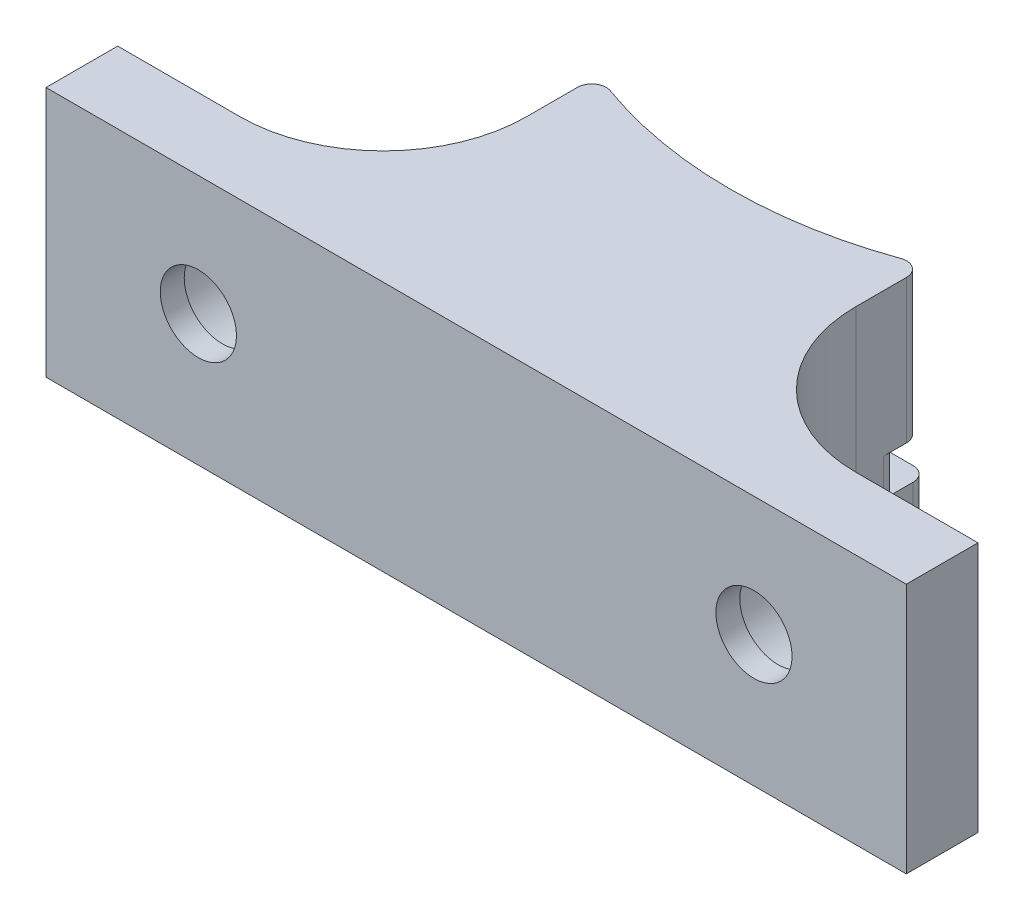
from build123d import *

# Parameters (mm, degrees)
BOSS_EXTRUDE1_DEPTH     = 25.4
BOSS_EXTRUDE2_DEPTH     = 6.604
SKETCH3_W               = 152.4
SKETCH3_H               = 50.8
BOSS_EXTRUDE3_DEPTH     = 12.446
SKETCH5_W               = 47.049242613
SKETCH5_H               = 38.1
CUT_EXTRUDE1_DEPTH      = 92.800885072
FILLET1_R               = 2.54
FILLET2_R               = 25.4
CUT_EXTRUDE2_DEPTH      = 8.4582
CUT_EXTRUDE2_DEPTH_BACK = 85.242269675
CUT_EXTRUDE2_START      = 12.7
SKETCH6_R               = 9.9187
SKETCH7_R               = 6.7437
CUT_EXTRUDE3_DEPTH      = 93.840002113


with BuildPart() as part:
    # Sketch1 → Boss-Extrude1 (new body)
    with BuildSketch(Plane(origin=(0, 0, 0), x_dir=(1, 0, 0), z_dir=(0, 1, 0))):
        with BuildLine():
            Line((76.2, -25.4), (76.2, 25.4))
            Line((76.2, 25.4), (29.150757387, 25.4))
            ThreePointArc((29.150757387, 25.4), (0, 19.601553837), (-29.150757387, 25.4))
            Line((-29.150757387, 25.4), (-76.2, 25.4))
            Line((-76.2, 25.4), (-76.2, -25.4))
            Line((-76.2, -25.4), (76.2, -25.4))
        make_face()
    extrude(amount=BOSS_EXTRUDE1_DEPTH)

    # Sketch2 → Boss-Extrude2 (add)
    with BuildSketch(Plane.XZ):
        with BuildLine():
            Line((-76.2, 25.4), (76.2, 25.4))
            Line((76.2, 25.4), (76.2, -21.59))
            Line((76.2, -21.59), (29.966893046, -21.59))
            ThreePointArc((29.966893046, -21.59), (0, -15.766153837), (-29.966893046, -21.59))
            Line((-29.966893046, -21.59), (-76.2, -21.59))
            Line((-76.2, -21.59), (-76.2, 25.4))
        make_face()
    extrude(amount=BOSS_EXTRUDE2_DEPTH)

    # Sketch3 → Boss-Extrude3 (add)
    with BuildSketch(Plane.XZ.offset(6.604)):
        Rectangle(SKETCH3_W, SKETCH3_H)
    extrude(amount=BOSS_EXTRUDE3_DEPTH)

    # Sketch5 → Cut-Extrude1 (cut, through all)
    with BuildSketch(Plane(origin=(0, 25.4, 0), x_dir=(1, 0, 0), z_dir=(0, 1, 0))):
        with Locations((-52.675378694, 6.35)):
            Rectangle(SKETCH5_W, SKETCH5_H)
        with Locations((52.675378694, 6.35)):
            Rectangle(SKETCH5_W, SKETCH5_H)
    extrude(amount=-CUT_EXTRUDE1_DEPTH, mode=Mode.SUBTRACT)

    # Fillet1
    fillet1_edges = [part.edges().sort_by_distance(p)[0] for p in [
        (29.150757387, 12.7, -25.4),
        (-29.150757387, 12.7, -25.4),
        (-29.150757387, -12.827, -25.4),
        (-29.150757387, -3.302, -21.265527456),
        (29.150757387, -12.827, -25.4),
        (29.150757387, -3.302, -21.265527456),
    ]]
    fillet(fillet1_edges, radius=FILLET1_R)

    # Fillet2
    fillet2_edges = [part.edges().sort_by_distance(p)[0] for p in [
        (-29.150757387, 3.175, 12.7),
        (29.150757387, 3.175, 12.7),
    ]]
    fillet(fillet2_edges, radius=FILLET2_R)

    # Sketch6 → Cut-Extrude2 (cut, two sides: drawn at the far end of the back side and taken through both)
    with BuildSketch(Plane.XY.offset(CUT_EXTRUDE2_START - CUT_EXTRUDE2_DEPTH_BACK)):
        with Locations(Location((49.2125, 4.191, 0), (0, 0, 302.561278337))):
            Circle(SKETCH6_R)
        with Locations(Location((-49.2125, 4.191, 0), (0, 0, 237.438721663))):
            Circle(SKETCH6_R)
    extrude(amount=CUT_EXTRUDE2_DEPTH + CUT_EXTRUDE2_DEPTH_BACK, mode=Mode.SUBTRACT)

    # Sketch7 → Cut-Extrude3 (cut, through all)
    with BuildSketch(Plane(origin=(0, 0, 21.1582), x_dir=(-1, 0, 0), z_dir=(0, 0, -1))):
        with Locations((-49.2125, 4.191)):
            Circle(SKETCH7_R)
        with Locations((49.2125, 4.191)):
            Circle(SKETCH7_R)
    extrude(amount=-CUT_EXTRUDE3_DEPTH, mode=Mode.SUBTRACT)


solid = part.part
